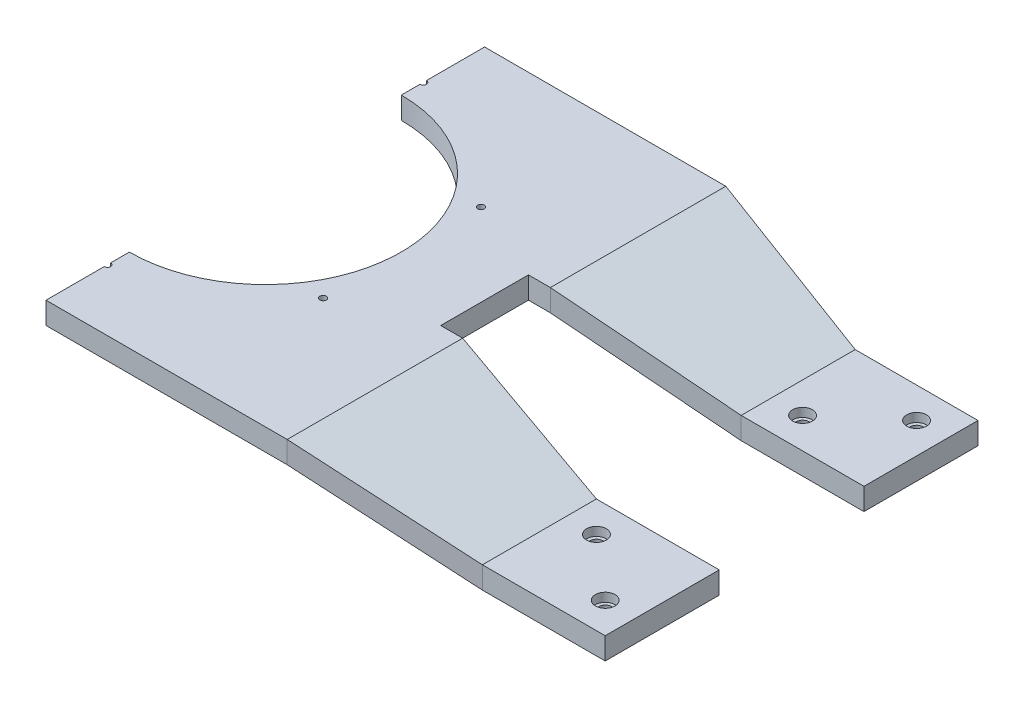
from build123d import *

# Parameters (mm, degrees)
SKETCH_1_W          = 28
SKETCH_1_H          = 26
EXTRUDE_1_DEPTH     = 5
EXTRUDE_1_2_DEPTH   = 5
EXTRUDE_START       = 10
SKETCH_1_12_W       = 50
SKETCH_1_12_H       = 100
EXTRUDE_2_DEPTH     = 5
SKETCH_2_W          = 40
SKETCH_2_H          = 5
EXTRUDE_3_DEPTH     = 5
SKETCH_3_R          = 1.5
CUT_EXTRUDE_1_DEPTH = 131.38404815
SKETCH_3_3_R        = 2.25
CUT_EXTRUDE_2_DEPTH = 2
SKETCH_4_R          = 0.75
CUT_EXTRUDE_3_DEPTH = 4
SKETCH_5_R          = 31
CUT_EXTRUDE_4_DEPTH = 131.862523333
SKETCH_6_W          = 400
SKETCH_6_H          = 200
CUT_EXTRUDE_5_DEPTH = 131.862523333


with BuildPart() as part:
    # 草图1 → 凸台-拉伸1 (new body)
    with BuildSketch(Plane(origin=(0, 0, 0), x_dir=(1, 0, 0), z_dir=(0, 1, 0))):
        with Locations((106, 29.5)):
            Rectangle(SKETCH_1_W, SKETCH_1_H)
    extrude(amount=EXTRUDE_1_DEPTH)


with BuildPart() as body_2:
    # 草图1 → Extrude 1 2 (new body)
    with BuildSketch(Plane(origin=(0, 0, 0), x_dir=(1, 0, 0), z_dir=(0, 1, 0))):
        with Locations((106, -29.5)):
            Rectangle(SKETCH_1_W, SKETCH_1_H)
    extrude(amount=EXTRUDE_1_2_DEPTH)


with BuildPart() as body_3:
    # 草图1<12> → 凸台-拉伸2 (new body)
    with BuildSketch(Plane(origin=(0, 0, 0), x_dir=(1, 0, 0), z_dir=(0, 1, 0)).offset(EXTRUDE_START)):
        with Locations((25, 0)):
            Rectangle(SKETCH_1_12_W, SKETCH_1_12_H)
    extrude(amount=EXTRUDE_2_DEPTH)

    # 草图2 → 凸台-拉伸3 (add)
    with BuildSketch(Plane(origin=(50, 0, 0), x_dir=(0, 0, -1), z_dir=(1, 0, 0))):
        with Locations((30, 12.5)):
            Rectangle(SKETCH_2_W, SKETCH_2_H)
        with Locations((-30, 12.5)):
            Rectangle(SKETCH_2_W, SKETCH_2_H)
    extrude(amount=EXTRUDE_3_DEPTH)


    add(body_2.part)  # loft_5 joins it to this body
    # loft from a face of the part (loft_5)
    loft([body_3.faces().sort_by_distance((55, 12.5, 30))[0], body_3.faces().sort_by_distance((92, 2.5, 29.5))[0]])


    add(part.part)  # loft_6 joins it to this body
    # loft from a face of the part (loft_6)
    loft([body_3.faces().sort_by_distance((55, 12.5, -30))[0], body_3.faces().sort_by_distance((92, 2.5, -29.5))[0]])

    # 草图3 → 切除-拉伸1 (cut, through all)
    with BuildSketch(Plane(origin=(0, 5, 0), x_dir=(1, 0, 0), z_dir=(0, 1, 0))):
        with Locations(Location((113, 35.5, 0), (0, 0, 270))):
            Circle(SKETCH_3_R)
        with Locations(Location((99, 23.5, 0), (0, 0, 270))):
            Circle(SKETCH_3_R)
        with Locations(Location((113, -35.5, 0), (0, 0, 270))):
            Circle(SKETCH_3_R)
        with Locations(Location((99, -23.5, 0), (0, 0, 270))):
            Circle(SKETCH_3_R)
    extrude(amount=-CUT_EXTRUDE_1_DEPTH, mode=Mode.SUBTRACT)

    # 草图3<3> → 切除-拉伸2 (cut)
    with BuildSketch(Plane(origin=(0, 5, 0), x_dir=(1, 0, 0), z_dir=(0, 1, 0))):
        with Locations(Location((99, 23.5, 0), (0, 0, 270))):
            Circle(SKETCH_3_3_R)
        with Locations(Location((113, 35.5, 0), (0, 0, 270))):
            Circle(SKETCH_3_3_R)
        with Locations(Location((113, -35.5, 0), (0, 0, 270))):
            Circle(SKETCH_3_3_R)
        with Locations(Location((99, -23.5, 0), (0, 0, 270))):
            Circle(SKETCH_3_3_R)
    extrude(amount=-CUT_EXTRUDE_2_DEPTH, mode=Mode.SUBTRACT)

    # 草图4 → 切除-拉伸3 (cut)
    with BuildSketch(Plane(origin=(0, 15, 0), x_dir=(1, 0, 0), z_dir=(0, 1, 0))):
        with Locations((0, 36)):
            Circle(SKETCH_4_R)
        with Locations(Location((31.176914536, 18, 0), (0, 0, 270))):
            Circle(SKETCH_4_R)
        with Locations(Location((31.176914536, -18, 0), (0, 0, 270))):
            Circle(SKETCH_4_R)
        with Locations((0, -36)):
            Circle(SKETCH_4_R)
    extrude(amount=-CUT_EXTRUDE_3_DEPTH, mode=Mode.SUBTRACT)

    # 草图5 → 切除-拉伸4 (cut, through all)
    with BuildSketch(Plane(origin=(0, 15, 0), x_dir=(1, 0, 0), z_dir=(0, 1, 0))):
        Circle(SKETCH_5_R)
    extrude(amount=-CUT_EXTRUDE_4_DEPTH, mode=Mode.SUBTRACT)


with BuildPart() as body_2_2:
    # 镜向1: mirrored copy
    add(body_3.part.mirror(Plane(origin=(0, 0, 0), x_dir=(0, 0, 1), z_dir=(1, 0, 0))))

    # 草图6 → 切除-拉伸5 (cut, through all)
    with BuildSketch(Plane(origin=(0, 0, 0), x_dir=(0, 0, -1), z_dir=(1, 0, 0))):
        Rectangle(SKETCH_6_W, SKETCH_6_H)
    extrude(amount=-CUT_EXTRUDE_5_DEPTH, mode=Mode.SUBTRACT)


solid = body_3.part
